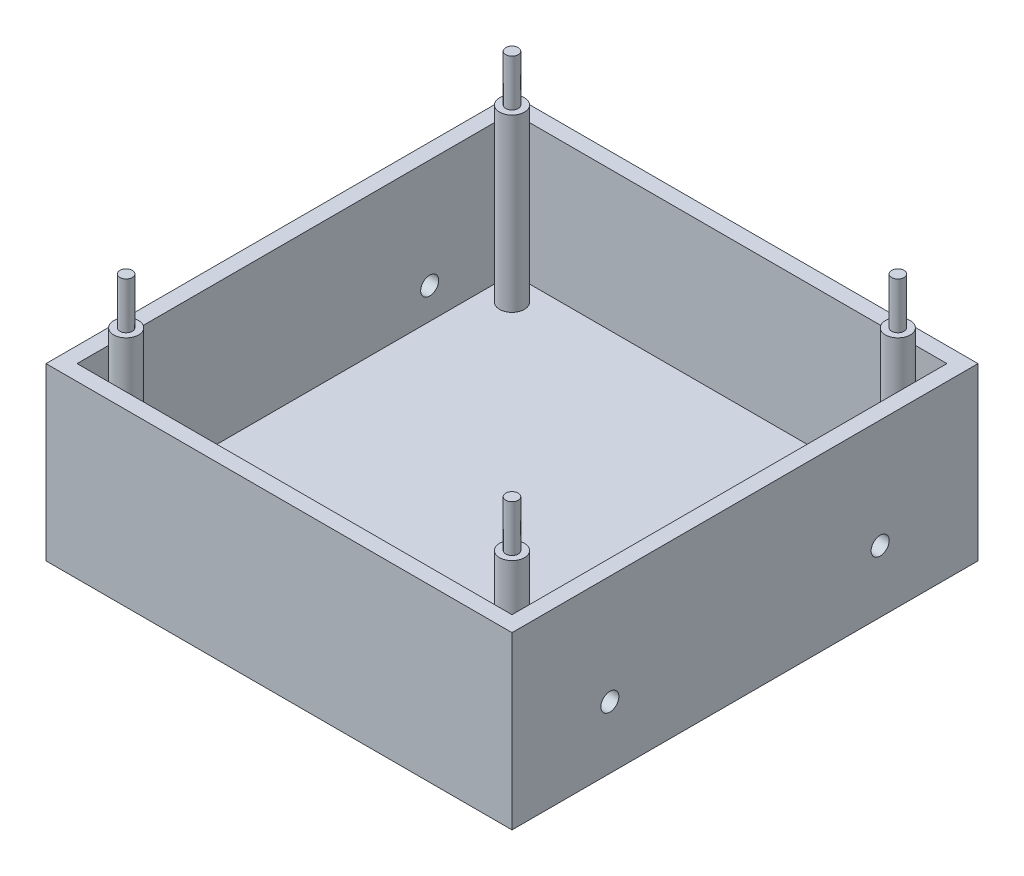
from build123d import *

# Parameters (mm, degrees)
SKETCH1_W               = 150
SKETCH1_H               = 150
SKETCH1_W_2             = 140
SKETCH1_H_2             = 140
BOSS_EXTRUDE1_DEPTH     = 55
SKETCH1_3_W             = 140
SKETCH1_3_H             = 140
SKETCH1_3_R             = 4
BOSS_EXTRUDE2_DEPTH     = 10
SKETCH1_4_R             = 4
SKETCH1_4_R_2           = 2
BOSS_EXTRUDE3_DEPTH     = 65
SKETCH1_5_R             = 2
BOSS_EXTRUDE4_DEPTH     = 80
CUT_EXTRUDE3_DEPTH      = 227.715680975
CUT_EXTRUDE3_DEPTH_BACK = 130
SKETCH3_R               = 2.9


with BuildPart() as part:
    # Sketch1 → Boss-Extrude1 (new body)
    with BuildSketch(Plane(origin=(0, 0, 0), x_dir=(1, 0, 0), z_dir=(0, 1, 0))):
        with Locations((75, -75)):
            Rectangle(SKETCH1_W, SKETCH1_H)
        with Locations((75, -75)):
            Rectangle(SKETCH1_W_2, SKETCH1_H_2, mode=Mode.SUBTRACT)
    extrude(amount=BOSS_EXTRUDE1_DEPTH)

    # Sketch1<3> → Boss-Extrude2 (add)
    with BuildSketch(Plane(origin=(0, 0, 0), x_dir=(1, 0, 0), z_dir=(0, 1, 0))):
        with Locations((75, -75)):
            Rectangle(SKETCH1_3_W, SKETCH1_3_H)
        with Locations((12.9, -137.1)):
            Circle(SKETCH1_3_R, mode=Mode.SUBTRACT)
        with Locations((137.1, -137.1)):
            Circle(SKETCH1_3_R, mode=Mode.SUBTRACT)
        with Locations((12.9, -12.9)):
            Circle(SKETCH1_3_R, mode=Mode.SUBTRACT)
        with Locations((137.1, -12.9)):
            Circle(SKETCH1_3_R, mode=Mode.SUBTRACT)
    extrude(amount=BOSS_EXTRUDE2_DEPTH)

    # Sketch1<4> → Boss-Extrude3 (add)
    # profile 1 of 4: a face of its own
    with BuildSketch(Plane(origin=(0, 0, 0), x_dir=(1, 0, 0), z_dir=(0, 1, 0))):
        with Locations((12.9, -12.9)):
            Circle(SKETCH1_4_R)
        with Locations((12.9, -12.9)):
            Circle(SKETCH1_4_R_2, mode=Mode.SUBTRACT)
    # profile 2 of 4: a face of its own
    with BuildSketch(Plane(origin=(0, 0, 0), x_dir=(1, 0, 0), z_dir=(0, 1, 0))):
        with Locations((137.1, -12.9)):
            Circle(SKETCH1_4_R)
        with Locations((137.1, -12.9)):
            Circle(SKETCH1_4_R_2, mode=Mode.SUBTRACT)
    # profile 3 of 4: a face of its own
    with BuildSketch(Plane(origin=(0, 0, 0), x_dir=(1, 0, 0), z_dir=(0, 1, 0))):
        with Locations((137.1, -137.1)):
            Circle(SKETCH1_4_R)
        with Locations((137.1, -137.1)):
            Circle(SKETCH1_4_R_2, mode=Mode.SUBTRACT)
    # profile 4 of 4: a face of its own
    with BuildSketch(Plane(origin=(0, 0, 0), x_dir=(1, 0, 0), z_dir=(0, 1, 0))):
        with Locations((12.9, -137.1)):
            Circle(SKETCH1_4_R)
        with Locations((12.9, -137.1)):
            Circle(SKETCH1_4_R_2, mode=Mode.SUBTRACT)
    extrude(amount=BOSS_EXTRUDE3_DEPTH)

    # Sketch1<5> → Boss-Extrude4 (add)
    with BuildSketch(Plane(origin=(0, 0, 0), x_dir=(1, 0, 0), z_dir=(0, 1, 0))):
        with Locations((12.9, -12.9)):
            Circle(SKETCH1_5_R)
        with Locations((137.1, -12.9)):
            Circle(SKETCH1_5_R)
        with Locations((137.1, -137.1)):
            Circle(SKETCH1_5_R)
        with Locations((12.9, -137.1)):
            Circle(SKETCH1_5_R)
    extrude(amount=BOSS_EXTRUDE4_DEPTH)

    # Sketch3 → Cut-Extrude3 (cut, two sides: drawn at the far end of the back side and taken through both)
    with BuildSketch(Plane(origin=(0, 0, 0), x_dir=(0, 0, -1), z_dir=(1, 0, 0)).offset(-CUT_EXTRUDE3_DEPTH_BACK)):
        with Locations((-31.5, 20)):
            Circle(SKETCH3_R)
        with Locations((-118.5, 20)):
            Circle(SKETCH3_R)
    extrude(amount=CUT_EXTRUDE3_DEPTH + CUT_EXTRUDE3_DEPTH_BACK, mode=Mode.SUBTRACT)


solid = part.part
